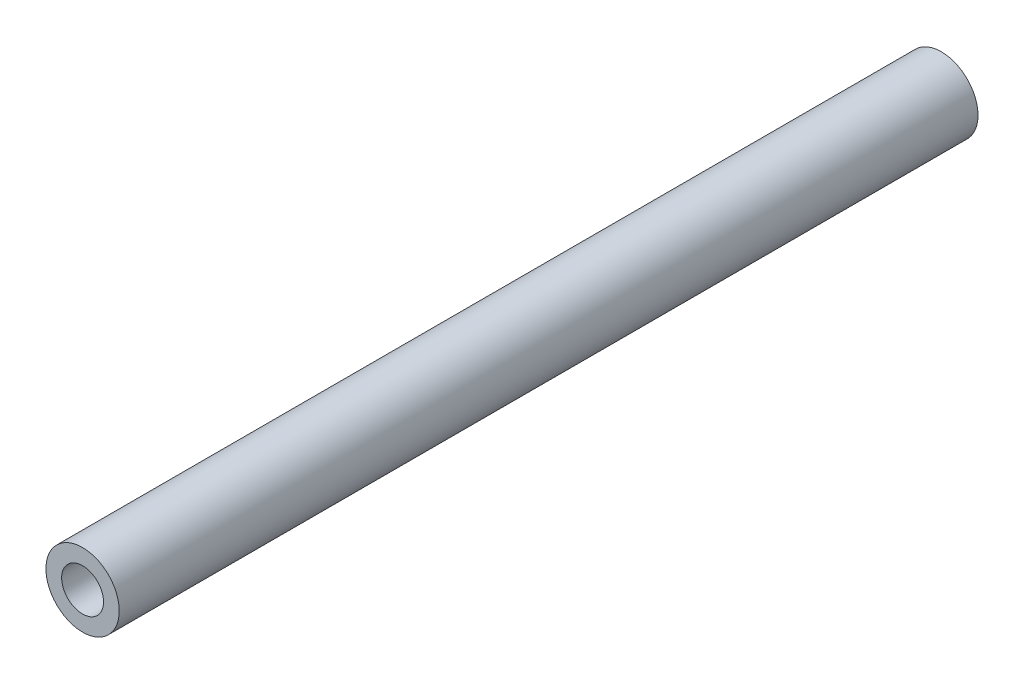
from build123d import *

# Parameters (mm, degrees)
SKETCH1_R           = 3.5
SKETCH1_R_2         = 2
BOSS_EXTRUDE1_DEPTH = 82


with BuildPart() as part:
    # Sketch1 → Boss-Extrude1 (new body)
    with BuildSketch(Plane.XY):
        with Locations((-15.982125076, 183.959163508)):
            Circle(SKETCH1_R)
        with Locations((-15.982125076, 183.959163508)):
            Circle(SKETCH1_R_2, mode=Mode.SUBTRACT)
    extrude(amount=BOSS_EXTRUDE1_DEPTH)


solid = part.part
